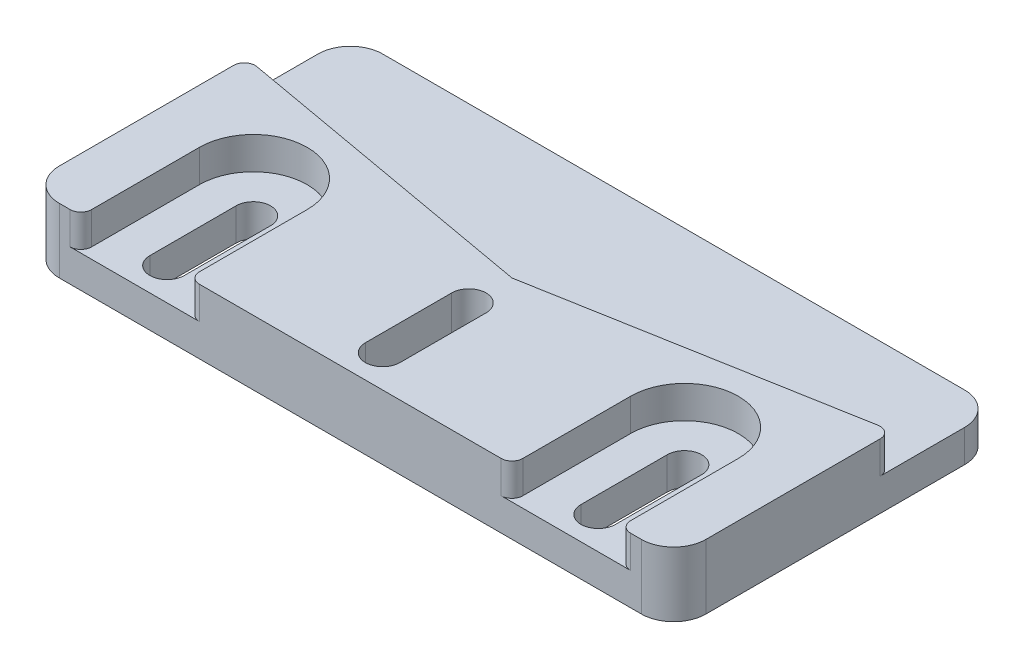
from build123d import *

# Parameters (mm, degrees)
BOSS_EXTRUDE1_DEPTH = 3
SKETCH4_W           = 60
SKETCH4_H           = 30
BOSS_EXTRUDE2_DEPTH = 3
FILLET1_R           = 3
CUT_EXTRUDE1_DEPTH  = 38.976966704
BOSS_EXTRUDE3_DEPTH = 3
CUT_EXTRUDE2_DEPTH  = 3
FILLET2_R           = 1


with BuildPart() as part:
    # Sketch2 → Boss-Extrude1 (new body)
    with BuildSketch(Plane(origin=(0, 0, 0), x_dir=(1, 0, 0), z_dir=(0, 1, 0))):
        with BuildLine():
            Line((-30, -7.5), (30, -7.5))
            Line((30, -7.5), (30, 11.664728706))
            ThreePointArc((30, 11.664728706), (29.572172135, 12.484862261), (28.654761905, 12.60324384))
            ThreePointArc((28.654761905, 12.60324384), (0, 7.5), (-28.654761905, 12.60324384))
            ThreePointArc((-28.654761905, 12.60324384), (-29.572172135, 12.484862261), (-30, 11.664728706))
            Line((-30, 11.664728706), (-30, -7.5))
        make_face()
    extrude(amount=BOSS_EXTRUDE1_DEPTH)

    # Sketch4 → Boss-Extrude2 (add)
    with BuildSketch(Plane.XZ):
        with Locations((0, -7.5)):
            Rectangle(SKETCH4_W, SKETCH4_H)
    extrude(amount=BOSS_EXTRUDE2_DEPTH)

    # Fillet1
    fillet1_edges = [part.edges().sort_by_distance(p)[0] for p in [
        (30, -1.5, -22.5),
        (30, 0, 7.5),
        (-30, 0, 7.5),
        (-30, -1.5, -22.5),
    ]]
    fillet(fillet1_edges, radius=FILLET1_R)

    # Sketch5 → Cut-Extrude1 (cut, through all)
    with BuildSketch(Plane(origin=(0, 3, 0), x_dir=(1, 0, 0), z_dir=(0, 1, 0))):
        with BuildLine():
            Line((1.6, 3.5), (1.6, -4.5))
            ThreePointArc((1.6, -4.5), (0, -6.1), (-1.6, -4.5))
            Line((-1.6, -4.5), (-1.6, 3.5))
            ThreePointArc((-1.6, 3.5), (0, 5.1), (1.6, 3.5))
        make_face()
        with BuildLine():
            Line((21.6, 3.5), (21.6, -4.5))
            ThreePointArc((21.6, -4.5), (20, -6.1), (18.4, -4.5))
            Line((18.4, -4.5), (18.4, 3.5))
            ThreePointArc((18.4, 3.5), (20, 5.1), (21.6, 3.5))
        make_face()
        with BuildLine():
            Line((-21.6, 3.5), (-21.6, -4.5))
            ThreePointArc((-21.6, -4.5), (-20, -6.1), (-18.4, -4.5))
            Line((-18.4, -4.5), (-18.4, 3.5))
            ThreePointArc((-18.4, 3.5), (-20, 5.1), (-21.6, 3.5))
        make_face()
    extrude(amount=-CUT_EXTRUDE1_DEPTH, mode=Mode.SUBTRACT)

    # Sketch6 → Boss-Extrude3 (add)
    with BuildSketch(Plane(origin=(0, 3, 0), x_dir=(1, 0, 0), z_dir=(0, 1, 0))):
        with BuildLine():
            Line((0, 7.5), (-28.824143961, 12.649144601))
            ThreePointArc((-28.824143961, 12.649144601), (-29.64192833, 12.43149335), (-30, 11.664728706))
            Line((-30, 11.664728706), (-30, -4.5))
            ThreePointArc((-30, -4.5), (-29.121320344, -6.621320344), (-27, -7.5))
            Line((-27, -7.5), (27, -7.5))
            ThreePointArc((27, -7.5), (29.121320344, -6.621320344), (30, -4.5))
            Line((30, -4.5), (30, 11.664728706))
            ThreePointArc((30, 11.664728706), (29.64192833, 12.43149335), (28.824143961, 12.649144601))
            Line((28.824143961, 12.649144601), (0, 7.5))
        make_face()
        with BuildLine():
            Line((-18.4, -4.5), (-18.4, 3.5))
            ThreePointArc((-18.4, 3.5), (-20, 5.1), (-21.6, 3.5))
            Line((-21.6, 3.5), (-21.6, -4.5))
            ThreePointArc((-21.6, -4.5), (-20, -6.1), (-18.4, -4.5))
        make_face(mode=Mode.SUBTRACT)
        with BuildLine():
            Line((1.6, -4.5), (1.6, 3.5))
            ThreePointArc((1.6, 3.5), (0, 5.1), (-1.6, 3.5))
            Line((-1.6, 3.5), (-1.6, -4.5))
            ThreePointArc((-1.6, -4.5), (0, -6.1), (1.6, -4.5))
        make_face(mode=Mode.SUBTRACT)
        with BuildLine():
            Line((21.6, -4.5), (21.6, 3.5))
            ThreePointArc((21.6, 3.5), (20, 5.1), (18.4, 3.5))
            Line((18.4, 3.5), (18.4, -4.5))
            ThreePointArc((18.4, -4.5), (20, -6.1), (21.6, -4.5))
        make_face(mode=Mode.SUBTRACT)
    extrude(amount=-BOSS_EXTRUDE3_DEPTH)

    # Sketch7 → Cut-Extrude2 (cut)
    with BuildSketch(Plane(origin=(0, 3, 0), x_dir=(1, 0, 0), z_dir=(0, 1, 0))):
        with BuildLine():
            Line((-15, 3.5), (-15, -15.7))
            ThreePointArc((-15, -15.7), (-20, -20.7), (-25, -15.7))
            Line((-25, -15.7), (-25, 3.5))
            ThreePointArc((-25, 3.5), (-20, 8.5), (-15, 3.5))
        make_face()
        with BuildLine():
            Line((25, 3.5), (25, -15.7))
            ThreePointArc((25, -15.7), (20, -20.7), (15, -15.7))
            Line((15, -15.7), (15, 3.5))
            ThreePointArc((15, 3.5), (20, 8.5), (25, 3.5))
        make_face()
    extrude(amount=-CUT_EXTRUDE2_DEPTH, mode=Mode.SUBTRACT)

    # Fillet2
    fillet2_edges = [part.edges().sort_by_distance(p)[0] for p in [
        (-15, 1.5, 7.5),
        (-25, 1.5, 7.5),
        (25, 1.5, 7.5),
        (15, 1.5, 7.5),
    ]]
    fillet(fillet2_edges, radius=FILLET2_R)


solid = part.part
